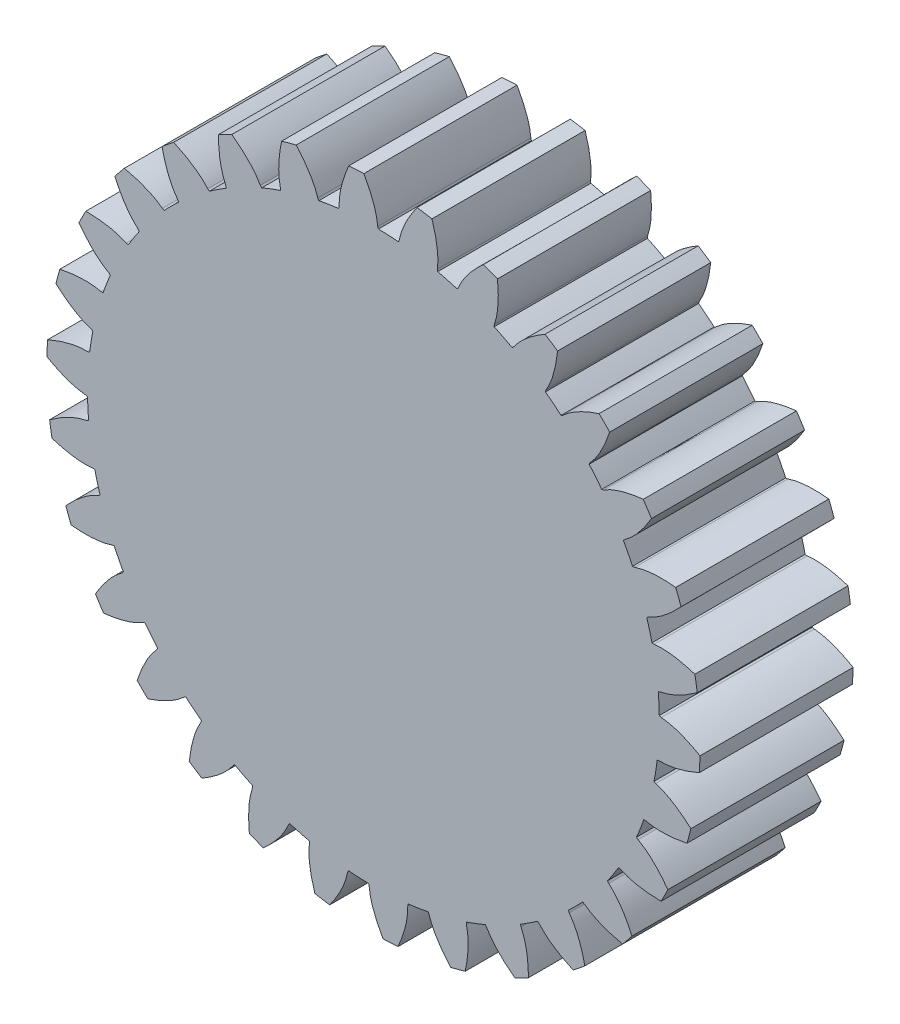
from build123d import *

# Parameters (mm, degrees)
SKETCH2_R           = 20.32
BOSS_EXTRUDE1_DEPTH = 4.7625
CUT_EXTRUDE1_DEPTH  = 31.2742535
CIRPATTERN1_COUNT   = 30


with BuildPart() as part:
    # Sketch2 → Boss-Extrude1 (new, symmetric)
    with BuildSketch(Plane.XY):
        with Locations(Location((0, 0, 0), (0, 0, 180))):
            Circle(SKETCH2_R)
    extrude(amount=BOSS_EXTRUDE1_DEPTH, both=True)

    # Sketch3 → Cut-Extrude1 (cut, symmetric)
    with BuildSketch(Plane.XY.offset(4.7625)):
        with BuildLine():
            ThreePointArc((0.308759425, 17.77731891), (0.930533302, 17.755633128), (1.551167818, 17.712207045))
            add(Edge.make_bspline(
                [(1.605637173, 17.828990466), (1.598898318, 17.808443197), (1.583635261, 17.768159997), (1.565918149, 17.728499738), (1.551167818, 17.712207045)],
                knots=[0, 0, 0, 0, 0.5, 1, 1, 1, 1], degree=3))
            add(Edge.make_bspline(
                [(2.715461265, 20.137742429), (2.533338598, 19.886461942), (2.062971793, 19.16596861), (1.712772915, 18.375013553), (1.605637173, 17.828990466)],
                knots=[0, 0, 0, 0, 0.361135124, 1, 1, 1, 1], degree=3))
            ThreePointArc((2.715461265, 20.137742429), (1.063466631, 20.292152146), (-0.595618414, 20.311268762))
            add(Edge.make_bspline(
                [(-0.595618414, 20.311268762), (-0.440759398, 20.042327813), (-0.048281372, 19.2766147), (0.217321763, 18.453386827), (0.26679565, 17.899156177)],
                knots=[0, 0, 0, 0, 0.361135124, 1, 1, 1, 1], degree=3))
            add(Edge.make_bspline(
                [(0.26679565, 17.899156177), (0.271349814, 17.878017066), (0.282318518, 17.836359118), (0.295792948, 17.795064179), (0.308759425, 17.77731891)],
                knots=[0, 0, 0, 0, 0.5, 1, 1, 1, 1], degree=3))
        make_face()
    cut_extrude1 = extrude(amount=CUT_EXTRUDE1_DEPTH, both=True, mode=Mode.SUBTRACT)

    # CirPattern1: Cut-Extrude1 ×30 about axis
    cirpattern1_axis = Axis((0, 0, 4.7625), (0, 0, -1))
    for i in range(1, CIRPATTERN1_COUNT):
        add(cut_extrude1.rotate(cirpattern1_axis, i * 360 / CIRPATTERN1_COUNT), mode=Mode.SUBTRACT)


solid = part.part
